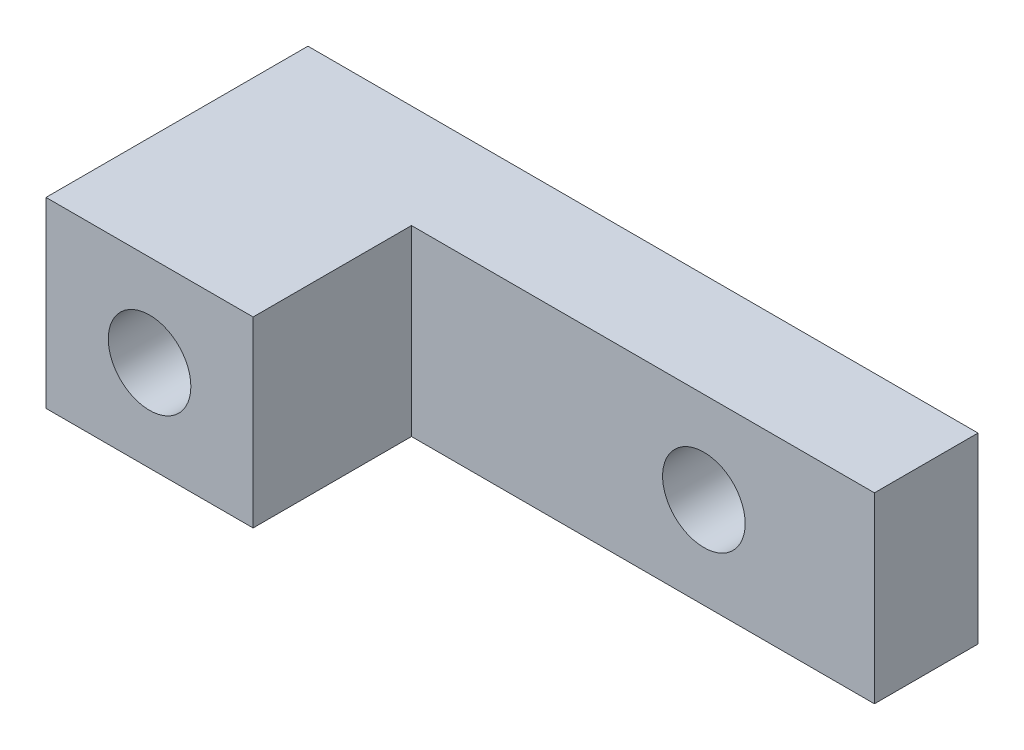
from build123d import *

# Parameters (mm, degrees)
BOSS_EXTRUDE1_DEPTH = 4.7625
SKETCH3_R           = 2.15265
CUT_EXTRUDE1_DEPTH  = 29.13057167


with BuildPart() as part:
    # Sketch1 → Boss-Extrude1 (new, symmetric)
    with BuildSketch(Plane(origin=(0, 0, 0), x_dir=(1, 0, 0), z_dir=(0, 1, 0))):
        Polygon((0, 0), (0, 8.255), (24.13, 8.255), (24.13, 13.6525), (-10.795, 13.6525), (-10.795, 0), align=None)
    extrude(amount=BOSS_EXTRUDE1_DEPTH, both=True)

    # Sketch3 → Cut-Extrude1 (cut, through all)
    with BuildSketch(Plane.XY):
        with Locations((15.24, 0)):
            Circle(SKETCH3_R)
        with Locations((-5.3975, 0)):
            Circle(SKETCH3_R)
    extrude(amount=-CUT_EXTRUDE1_DEPTH, mode=Mode.SUBTRACT)


solid = part.part
